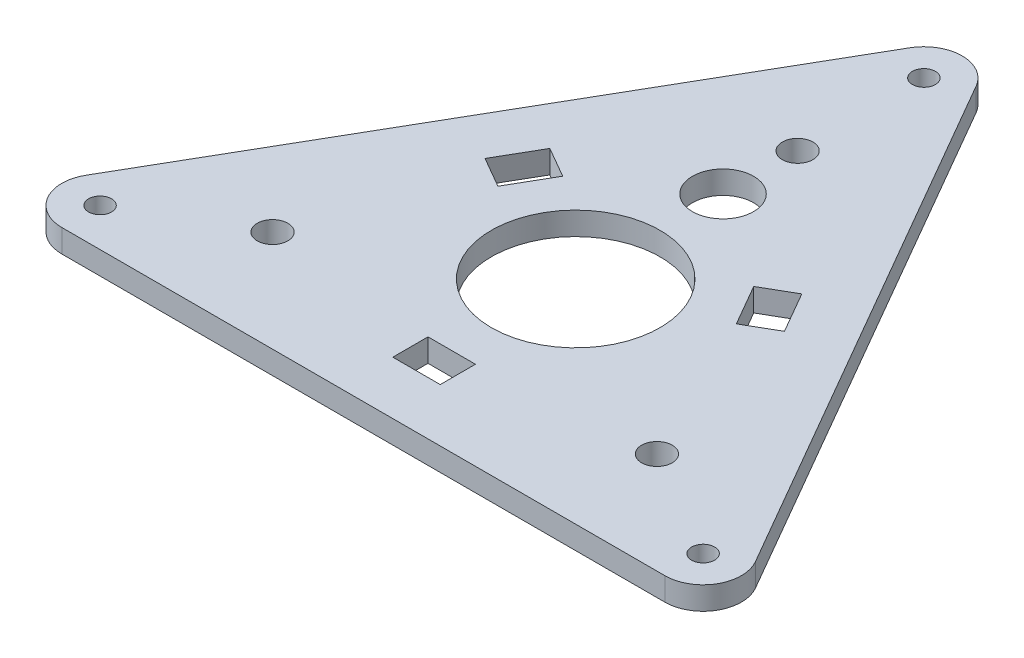
from build123d import *

# Parameters (mm, degrees)
SKETCH_1_R      = 11.025
SKETCH_1_R_2    = 1.5
SKETCH_1_R_3    = 2
SKETCH_1_R_4    = 4
SKETCH_1_W      = 6.2
SKETCH_1_H      = 4.6
EXTRUDE_1_DEPTH = 3


with BuildPart() as part:
    # 草图1 → 凸台-拉伸1 (new body)
    with BuildSketch(Plane(origin=(0, 0, 0), x_dir=(1, 0, 0), z_dir=(0, 1, 0))):
        with BuildLine():
            Line((-4.330127019, 48), (-43.734282891, -20.25))
            ThreePointArc((-43.734282891, -20.25), (-43.734282891, -25.25), (-39.404155872, -27.75))
            Line((-39.404155872, -27.75), (39.404155872, -27.75))
            ThreePointArc((39.404155872, -27.75), (43.734282891, -25.25), (43.734282891, -20.25))
            Line((43.734282891, -20.25), (4.330127019, 48))
            ThreePointArc((4.330127019, 48), (0, 50.5), (-4.330127019, 48))
        make_face()
        with Locations(Location((0, 0, 0), (0, 0, 270))):
            Circle(SKETCH_1_R, mode=Mode.SUBTRACT)
        with Locations(Location((0, 45.5, 0), (0, 0, 270))):
            Circle(SKETCH_1_R_2, mode=Mode.SUBTRACT)
        with Locations(Location((39.404155872, -22.75, 0), (0, 0, 270))):
            Circle(SKETCH_1_R_2, mode=Mode.SUBTRACT)
        with Locations(Location((-39.404155872, -22.75, 0), (0, 0, 270))):
            Circle(SKETCH_1_R_2, mode=Mode.SUBTRACT)
        with Locations(Location((0, 29, 0), (0, 0, 270))):
            Circle(SKETCH_1_R_3, mode=Mode.SUBTRACT)
        with Locations(Location((25.11473671, -14.5, 0), (0, 0, 270))):
            Circle(SKETCH_1_R_3, mode=Mode.SUBTRACT)
        with Locations(Location((-25.11473671, -14.5, 0), (0, 0, 270))):
            Circle(SKETCH_1_R_3, mode=Mode.SUBTRACT)
        with Locations(Location((0, 19.25, 0), (0, 0, 270))):
            Circle(SKETCH_1_R_4, mode=Mode.SUBTRACT)
        Polygon((-12.479611541, 10.784678752), (-16.463328399, 13.084678752), (-19.563328399, 7.715321248), (-15.579611541, 5.415321248), align=None, mode=Mode.SUBTRACT)
        with Locations((0, -18.5)):
            Rectangle(SKETCH_1_W, SKETCH_1_H, mode=Mode.SUBTRACT)
        Polygon((15.579611541, 5.415321248), (19.563328399, 7.715321248), (16.463328399, 13.084678752), (12.479611541, 10.784678752), align=None, mode=Mode.SUBTRACT)
    extrude(amount=EXTRUDE_1_DEPTH)


solid = part.part
